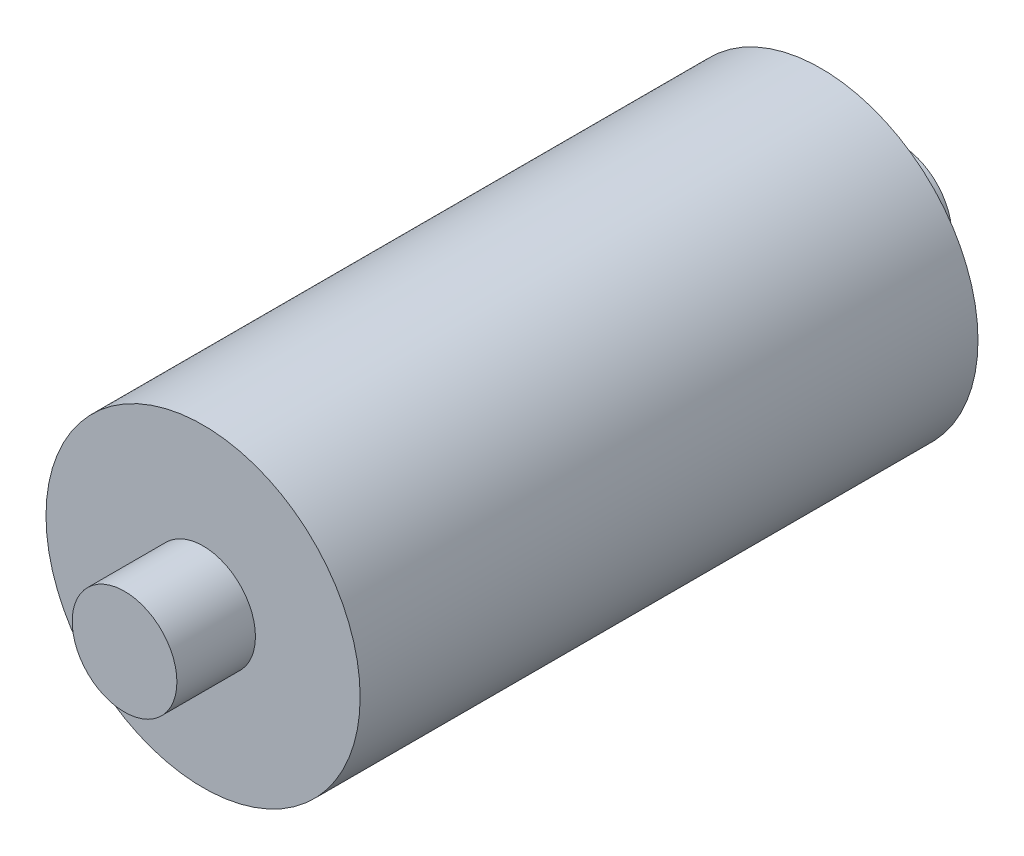
from build123d import *

# Parameters (mm, degrees)
SKETCH1_R           = 15
BOSS_EXTRUDE1_DEPTH = 29.5
SKETCH2_R           = 5
BOSS_EXTRUDE2_DEPTH = 7.5
SKETCH3_R           = 5
BOSS_EXTRUDE3_DEPTH = 7.5


with BuildPart() as part:
    # Sketch1 → Boss-Extrude1 (new, symmetric)
    with BuildSketch(Plane.XY):
        Circle(SKETCH1_R)
    extrude(amount=BOSS_EXTRUDE1_DEPTH, both=True)

    # Sketch2 → Boss-Extrude2 (add, symmetric)
    with BuildSketch(Plane.XY.offset(29.5)):
        Circle(SKETCH2_R)
    extrude(amount=BOSS_EXTRUDE2_DEPTH, both=True)

    # Sketch3 → Boss-Extrude3 (add, symmetric)
    with BuildSketch(Plane(origin=(0, 0, -29.5), x_dir=(-1, 0, 0), z_dir=(0, 0, -1))):
        with Locations(Location((0, 0, 0), (0, 0, 180))):
            Circle(SKETCH3_R)
    extrude(amount=BOSS_EXTRUDE3_DEPTH, both=True)


solid = part.part
